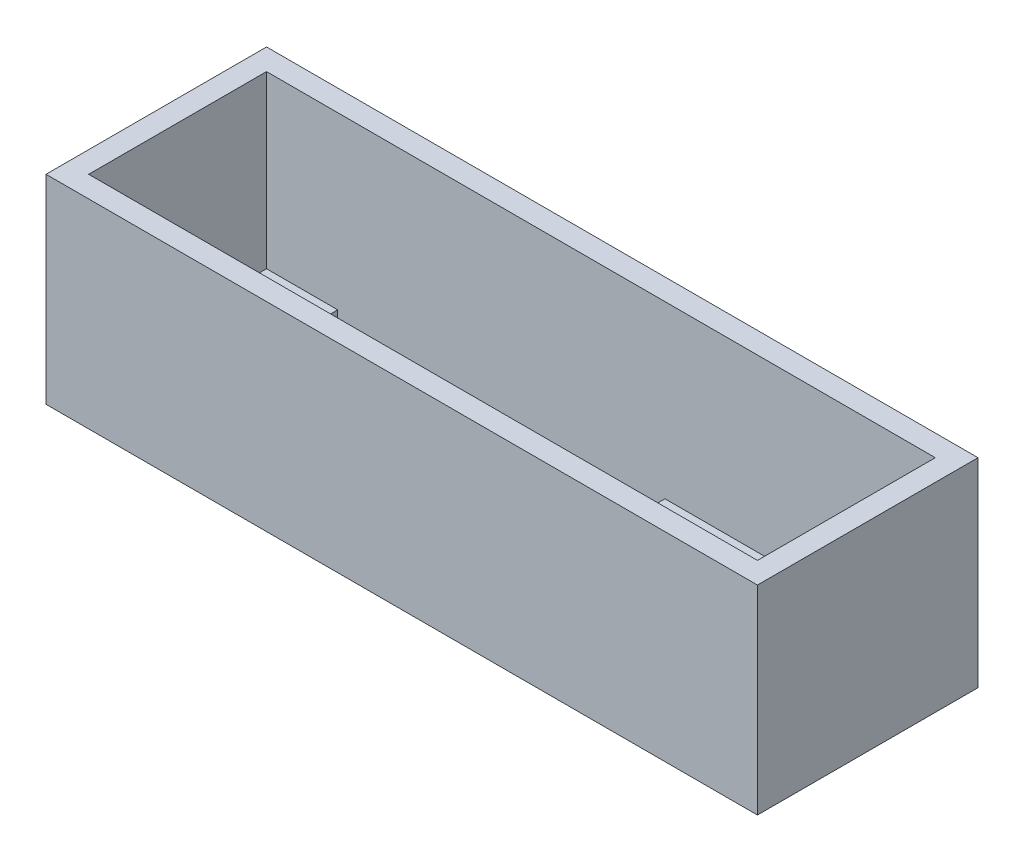
from build123d import *

# Parameters (mm, degrees)
SKETCH_1_W          = 50
SKETCH_1_H          = 15.5
EXTRUDE_1_DEPTH     = 14
SKETCH_2_W          = 47
SKETCH_2_H          = 12.5
CUT_EXTRUDE_1_DEPTH = 12
SKETCH_4_R          = 1.15
SKETCH_4_R_2        = 1.806882298
SKETCH_4_W          = 23
SKETCH_4_H          = 12.5
CUT_EXTRUDE_2_DEPTH = 2


with BuildPart() as part:
    # 草图1 → 凸台-拉伸1 (new body)
    with BuildSketch(Plane(origin=(0, 0, 0), x_dir=(1, 0, 0), z_dir=(0, 1, 0))):
        with Locations((25, 7.75)):
            Rectangle(SKETCH_1_W, SKETCH_1_H)
    extrude(amount=EXTRUDE_1_DEPTH)

    # 草图2 → 切除-拉伸1 (cut)
    with BuildSketch(Plane(origin=(0, 14, 0), x_dir=(1, 0, 0), z_dir=(0, 1, 0))):
        with Locations((25, 7.75)):
            Rectangle(SKETCH_2_W, SKETCH_2_H)
    extrude(amount=-CUT_EXTRUDE_1_DEPTH, mode=Mode.SUBTRACT)

    # 草图4 → 切除-拉伸2 (cut)
    with BuildSketch(Plane(origin=(0, 2, 0), x_dir=(1, 0, 0), z_dir=(0, 1, 0))):
        with Locations(Location((4.1, 7.75, 0), (0, 0, 270))):
            Circle(SKETCH_4_R)
        with Locations(Location((31.9, 7.75, 0), (0, 0, 270))):
            Circle(SKETCH_4_R)
        with Locations(Location((39.65, 7.75, 0), (0, 0, 270))):
            Circle(SKETCH_4_R_2)
        with Locations((18, 7.75)):
            Rectangle(SKETCH_4_W, SKETCH_4_H)
    extrude(amount=-CUT_EXTRUDE_2_DEPTH, mode=Mode.SUBTRACT)


solid = part.part
